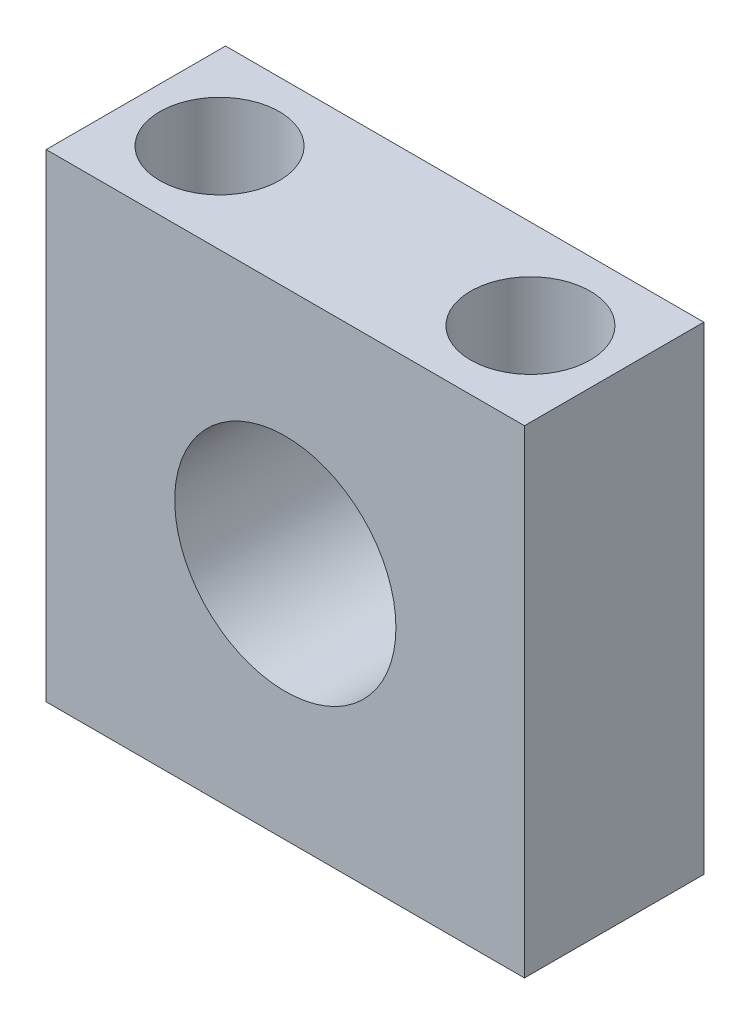
from build123d import *

# Parameters (mm, degrees)
SKETCH_4_W                   = 40
SKETCH_4_H                   = 40
EXTRUDE_2_DEPTH              = 15
M20X1_5_2_D                  = 18.5
M20X1_5_2_DEPTH              = 44.5
M20X1_5_2_TIP                = 5.557960726
HOLE_WIZARD_M6_1_D           = 6.6
HOLE_WIZARD_M6_1_CBORE_D     = 10
HOLE_WIZARD_M6_1_CBORE_DEPTH = 10


with BuildPart() as part:
    # 草图4 → 凸台-拉伸2 (new body)
    with BuildSketch(Plane.XY):
        Rectangle(SKETCH_4_W, SKETCH_4_H)
    extrude(amount=EXTRUDE_2_DEPTH)

    # M20x1.5 螺纹孔2
    with Locations(Plane.XY.offset(15)):
        with Locations((0, 0)):
            Hole(M20X1_5_2_D / 2, depth=M20X1_5_2_DEPTH)
            with Locations((0, 0, -(M20X1_5_2_DEPTH + M20X1_5_2_TIP / 2))):  # 118° drill point
                Cone(0, M20X1_5_2_D / 2, M20X1_5_2_TIP, mode=Mode.SUBTRACT)

    # M6 凹头盖螺钉的柱形沉头孔1 (through all)
    with Locations(Plane(origin=(0, 20, 0), x_dir=(-1, 0, 0), z_dir=(0, 1, 0))):
        with Locations((13, 7.5), (-13, 7.5)):
            CounterBoreHole(HOLE_WIZARD_M6_1_D / 2, HOLE_WIZARD_M6_1_CBORE_D / 2, HOLE_WIZARD_M6_1_CBORE_DEPTH)


solid = part.part
